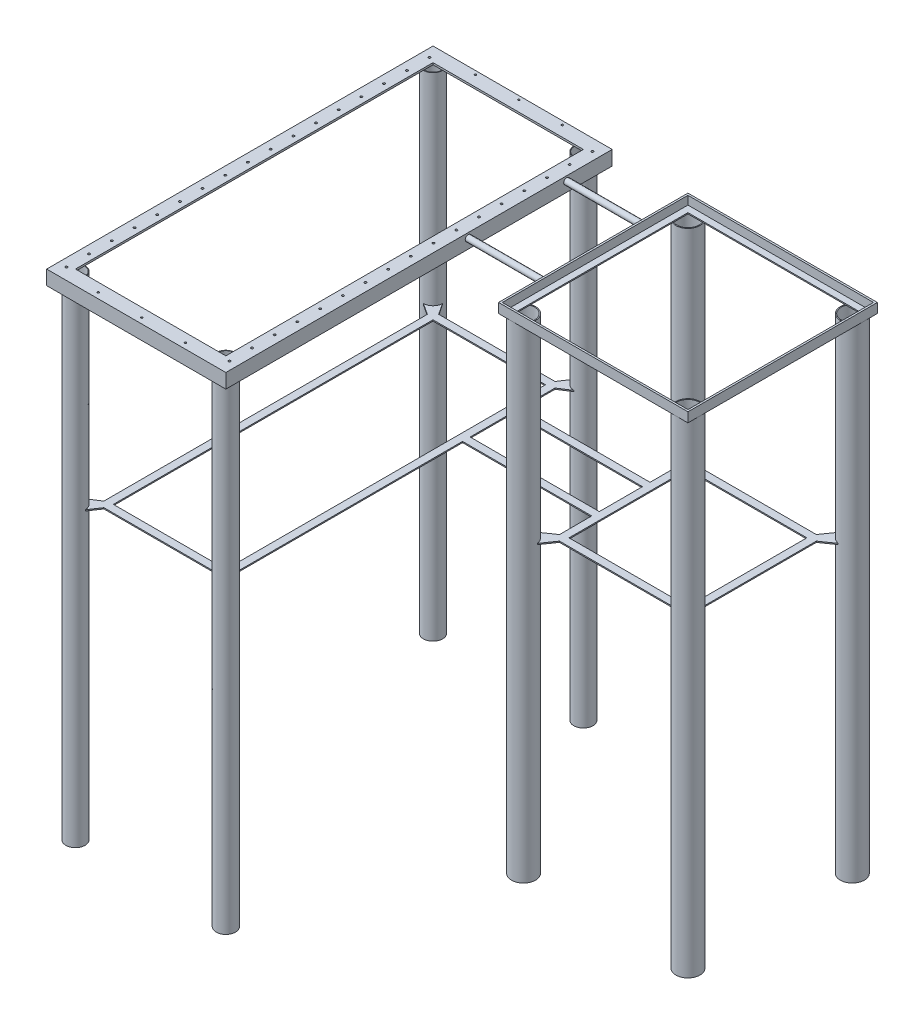
from build123d import *

# Parameters (mm, degrees)
CROQUIS1_W               = 473
CROQUIS1_H               = 1020
CROQUIS1_W_2             = 397
CROQUIS1_H_2             = 944
SALIENTE_EXTRUIR1_DEPTH  = 5
CROQUIS2_W               = 473
CROQUIS2_H               = 1020
CROQUIS2_W_2             = 463
CROQUIS2_H_2             = 1010
SALIENTE_EXTRUIR2_DEPTH  = 33
CROQUIS3_R               = 25.4
CROQUIS3_R_2             = 23.9
SALIENTE_EXTRUIR3_DEPTH  = 1300
SALIENTE_EXTRUIR4_START  = 533
CROQUIS4_W               = 337
CROQUIS4_H               = 884
CROQUIS4_W_2             = 297
CROQUIS4_H_2             = 844
SALIENTE_EXTRUIR4_DEPTH  = 3
SALIENTE_EXTRUIR5_DEPTH  = 3
SALIENTE_EXTRUIR6_START  = -22.225
CROQUIS6_W               = 500
CROQUIS6_H               = 500
CROQUIS6_W_2             = 455.55
CROQUIS6_H_2             = 455.55
SALIENTE_EXTRUIR6_DEPTH  = 3
CROQUIS7_W               = 500
CROQUIS7_H               = 500
CROQUIS7_W_2             = 490
CROQUIS7_H_2             = 490
SALIENTE_EXTRUIR7_DEPTH  = 25.4
SALIENTE_EXTRUIR8_REACH  = 1552.171
CROQUIS9_R               = 7.9375
CROQUIS10_R              = 31.75
CROQUIS10_R_2            = 29.25
SALIENTE_EXTRUIR9_DEPTH  = 1279.775
CROQUIS11_W              = 354
CROQUIS11_H              = 354
CROQUIS11_W_2            = 314
CROQUIS11_H_2            = 314
SALIENTE_EXTRUIR10_DEPTH = 3
SALIENTE_EXTRUIR11_START = -3
CROQUIS12_W              = 341
CROQUIS12_H              = 20
SALIENTE_EXTRUIR11_DEPTH = 3
CORTE_EXTRUS_O1_REACH    = 1687.277
ESBO_O1_R                = 2.5
ESBO_O2_R                = 2.87
CORTE_EXTRUS_O2_DEPTH    = 5


with BuildPart() as part:
    # Croquis1 → Saliente-Extruir1 (new body)
    with BuildSketch(Plane(origin=(0, 0, 0), x_dir=(1, 0, 0), z_dir=(0, 1, 0))):
        Rectangle(CROQUIS1_W, CROQUIS1_H)
        Rectangle(CROQUIS1_W_2, CROQUIS1_H_2, mode=Mode.SUBTRACT)
    extrude(amount=SALIENTE_EXTRUIR1_DEPTH)

    # Croquis2 → Saliente-Extruir2 (add)
    with BuildSketch(Plane.XZ):
        Rectangle(CROQUIS2_W, CROQUIS2_H)
        Rectangle(CROQUIS2_W_2, CROQUIS2_H_2, mode=Mode.SUBTRACT)
    extrude(amount=SALIENTE_EXTRUIR2_DEPTH)

    # Croquis3 → Saliente-Extruir3 (add)
    # profile 1 of 4: a face of its own
    with BuildSketch(Plane.XZ):
        with Locations(Location((-198.5, -472, 0), (0, 0, 90))):
            Circle(CROQUIS3_R)
        with Locations(Location((-198.5, -472, 0), (0, 0, 90))):
            Circle(CROQUIS3_R_2, mode=Mode.SUBTRACT)
    # profile 2 of 4: a face of its own
    with BuildSketch(Plane.XZ):
        with Locations(Location((198.5, -472, 0), (0, 0, 90))):
            Circle(CROQUIS3_R)
        with Locations(Location((198.5, -472, 0), (0, 0, 90))):
            Circle(CROQUIS3_R_2, mode=Mode.SUBTRACT)
    # profile 3 of 4: a face of its own
    with BuildSketch(Plane.XZ):
        with Locations(Location((-198.5, 472, 0), (0, 0, 90))):
            Circle(CROQUIS3_R)
        with Locations(Location((-198.5, 472, 0), (0, 0, 90))):
            Circle(CROQUIS3_R_2, mode=Mode.SUBTRACT)
    # profile 4 of 4: a face of its own
    with BuildSketch(Plane.XZ):
        with Locations(Location((198.5, 472, 0), (0, 0, 270))):
            Circle(CROQUIS3_R)
        with Locations(Location((198.5, 472, 0), (0, 0, 270))):
            Circle(CROQUIS3_R_2, mode=Mode.SUBTRACT)
    extrude(amount=SALIENTE_EXTRUIR3_DEPTH)



with BuildPart() as body_2:
    # Croquis4 → Saliente-Extruir4 (new body)
    with BuildSketch(Plane.XZ.offset(SALIENTE_EXTRUIR4_START)):
        Rectangle(CROQUIS4_W, CROQUIS4_H)
        Rectangle(CROQUIS4_W_2, CROQUIS4_H_2, mode=Mode.SUBTRACT)
    extrude(amount=SALIENTE_EXTRUIR4_DEPTH)


with BuildPart() as part_1:
    add(part.part)

    add(body_2.part)  # Saliente-Extruir5 merges body 2
    # Croquis5 → Saliente-Extruir5 (add)
    with BuildSketch(Plane(origin=(0, -533, 0), x_dir=(1, 0, 0), z_dir=(0, 1, 0))):
        Polygon((153.5, 442), (173.111763161, 471.227063899), (181.912911096, 457.745602739), (198.522990295, 446.600010405), (168.5, 427), (168.5, 442), align=None)
        Polygon((-198.522990295, 446.600010405), (-168.5, 427), (-168.5, 442), (-153.5, 442), (-173.111763161, 471.227063899), (-181.912911096, 457.745602739), align=None)
        Polygon((168.5, -442), (153.5, -442), (173.111763161, -471.227063899), (181.912911096, -457.745602739), (198.522990295, -446.600010405), (168.5, -427), align=None)
        Polygon((-153.5, -442), (-173.111763161, -471.227063899), (-181.912911096, -457.745602739), (-198.522990295, -446.600010405), (-168.5, -427), (-168.5, -442), align=None)
    extrude(amount=-SALIENTE_EXTRUIR5_DEPTH)

    # Croquis9 → Saliente-Extruir8 (add, up to next)
    with BuildSketch(Plane.ZY.offset(-436.5), mode=Mode.PRIVATE) as saliente_extruir8_sk1:
        with Locations((-390, -7.525)):
            Circle(CROQUIS9_R)
    saliente_extruir8_tool1 = extrude(saliente_extruir8_sk1.sketch, amount=SALIENTE_EXTRUIR8_REACH, mode=Mode.PRIVATE) - part_1.part
    # Croquis9 → Saliente-Extruir8 (add, up to next)
    with BuildSketch(Plane.ZY.offset(-436.5), mode=Mode.PRIVATE) as saliente_extruir8_sk2:
        with Locations((-130, -7.525)):
            Circle(CROQUIS9_R)
    saliente_extruir8_tool2 = extrude(saliente_extruir8_sk2.sketch, amount=SALIENTE_EXTRUIR8_REACH, mode=Mode.PRIVATE) - part_1.part


with BuildPart() as body_2_2:
    # Croquis6 → Saliente-Extruir6 (new body)
    with BuildSketch(Plane(origin=(0, 5, 0), x_dir=(1, 0, 0), z_dir=(0, 1, 0)).offset(SALIENTE_EXTRUIR6_START)):
        with Locations((686.5, 260)):
            Rectangle(CROQUIS6_W, CROQUIS6_H)
        with Locations((686.5, 260)):
            Rectangle(CROQUIS6_W_2, CROQUIS6_H_2, mode=Mode.SUBTRACT)
    extrude(amount=-SALIENTE_EXTRUIR6_DEPTH)

    # Croquis7 → Saliente-Extruir7 (add)
    with BuildSketch(Plane.XZ.offset(20.225)):
        with Locations((686.5, -260)):
            Rectangle(CROQUIS7_W, CROQUIS7_H)
        with Locations((686.5, -260)):
            Rectangle(CROQUIS7_W_2, CROQUIS7_H_2, mode=Mode.SUBTRACT)
    extrude(amount=-SALIENTE_EXTRUIR7_DEPTH)


with BuildPart() as part_2:
    add(part_1.part)

    add(body_2_2.part)  # Saliente-Extruir8 merges body 2 2
    add(saliente_extruir8_tool1.solids().sort_by_distance((436.5, -7.525, -390))[0])
    add(saliente_extruir8_tool2.solids().sort_by_distance((436.5, -7.525, -130))[0])

    # Croquis10 → Saliente-Extruir9 (add)
    # profile 1 of 4: a face of its own
    with BuildSketch(Plane.XZ.offset(20.225)):
        with Locations(Location((469.5, -43, 0), (0, 0, 90))):
            Circle(CROQUIS10_R)
        with Locations(Location((469.5, -43, 0), (0, 0, 90))):
            Circle(CROQUIS10_R_2, mode=Mode.SUBTRACT)
    # profile 2 of 4: a face of its own
    with BuildSketch(Plane.XZ.offset(20.225)):
        with Locations(Location((469.5, -477, 0), (0, 0, 90))):
            Circle(CROQUIS10_R)
        with Locations(Location((469.5, -477, 0), (0, 0, 90))):
            Circle(CROQUIS10_R_2, mode=Mode.SUBTRACT)
    # profile 3 of 4: a face of its own
    with BuildSketch(Plane.XZ.offset(20.225)):
        with Locations(Location((903.5, -477, 0), (0, 0, 90))):
            Circle(CROQUIS10_R)
        with Locations(Location((903.5, -477, 0), (0, 0, 90))):
            Circle(CROQUIS10_R_2, mode=Mode.SUBTRACT)
    # profile 4 of 4: a face of its own
    with BuildSketch(Plane.XZ.offset(20.225)):
        with Locations(Location((903.5, -43, 0), (0, 0, 90))):
            Circle(CROQUIS10_R)
        with Locations(Location((903.5, -43, 0), (0, 0, 90))):
            Circle(CROQUIS10_R_2, mode=Mode.SUBTRACT)
    extrude(amount=SALIENTE_EXTRUIR9_DEPTH)



with BuildPart() as body_2_3:
    # Croquis11 → Saliente-Extruir10 (new body)
    with BuildSketch(Plane(origin=(0, -533, 0), x_dir=(1, 0, 0), z_dir=(0, 1, 0))):
        with Locations((686.5, 260)):
            Rectangle(CROQUIS11_W, CROQUIS11_H)
        with Locations((686.5, 260)):
            Rectangle(CROQUIS11_W_2, CROQUIS11_H_2, mode=Mode.SUBTRACT)
    extrude(amount=-SALIENTE_EXTRUIR10_DEPTH)


with BuildPart() as part_3:
    add(part_2.part)

    add(body_2_3.part)  # Saliente-Extruir11 merges body 2 3
    # Croquis12 → Saliente-Extruir11 (add)
    with BuildSketch(Plane(origin=(0, -533, 0), x_dir=(1, 0, 0), z_dir=(0, 1, 0)).offset(SALIENTE_EXTRUIR11_START)):
        Polygon((509.5, 422), (475.09561414, 446.090210327), (491.346586648, 453.961138226), (500.409789673, 471.40438586), (524.5, 437), (509.5, 437), align=None)
        Polygon((863.5, 437), (863.5, 422), (897.90438586, 446.090210327), (881.653413352, 453.961138226), (872.590210327, 471.40438586), (848.5, 437), align=None)
        Polygon((863.5, 98), (897.90438586, 73.909789673), (881.653413352, 66.038861774), (872.590210327, 48.59561414), (848.5, 83), (863.5, 83), align=None)
        Polygon((509.5, 83), (509.5, 98), (475.09561414, 73.909789673), (491.346586648, 66.038861774), (500.409789673, 48.59561414), (524.5, 83), align=None)
        with Locations((339, 327)):
            Rectangle(CROQUIS12_W, CROQUIS12_H)
        with Locations((339, 193)):
            Rectangle(CROQUIS12_W, CROQUIS12_H)
    extrude(amount=SALIENTE_EXTRUIR11_DEPTH)

    # Esboço1 → Corte-extrusão1 (cut, up to next)
    with BuildSketch(Plane(origin=(0, 5, 0), x_dir=(1, 0, 0), z_dir=(0, 1, 0)), mode=Mode.PRIVATE) as corte_extrus_o1_sk1:
        with Locations(Location((-114.988057923, -495.2375, 0), (0, 0, 270))):
            Circle(ESBO_O1_R)
    corte_extrus_o1_tool1 = extrude(corte_extrus_o1_sk1.sketch, amount=-CORTE_EXTRUS_O1_REACH, mode=Mode.PRIVATE) & part_3.part
    # Esboço1 → Corte-extrusão1 (cut, up to next)
    with BuildSketch(Plane(origin=(0, 5, 0), x_dir=(1, 0, 0), z_dir=(0, 1, 0)), mode=Mode.PRIVATE) as corte_extrus_o1_sk2:
        with Locations(Location((0.011942077, -495.2375, 0), (0, 0, 270))):
            Circle(ESBO_O1_R)
    corte_extrus_o1_tool2 = extrude(corte_extrus_o1_sk2.sketch, amount=-CORTE_EXTRUS_O1_REACH, mode=Mode.PRIVATE) & part_3.part
    # Esboço1 → Corte-extrusão1 (cut, up to next)
    with BuildSketch(Plane(origin=(0, 5, 0), x_dir=(1, 0, 0), z_dir=(0, 1, 0)), mode=Mode.PRIVATE) as corte_extrus_o1_sk3:
        with Locations(Location((115.011942077, -495.2375, 0), (0, 0, 270))):
            Circle(ESBO_O1_R)
    corte_extrus_o1_tool3 = extrude(corte_extrus_o1_sk3.sketch, amount=-CORTE_EXTRUS_O1_REACH, mode=Mode.PRIVATE) & part_3.part
    # Esboço1 → Corte-extrusão1 (cut, up to next)
    with BuildSketch(Plane(origin=(0, 5, 0), x_dir=(1, 0, 0), z_dir=(0, 1, 0)), mode=Mode.PRIVATE) as corte_extrus_o1_sk4:
        with Locations(Location((-114.988057923, 500.2375, 0), (0, 0, 270))):
            Circle(ESBO_O1_R)
    corte_extrus_o1_tool4 = extrude(corte_extrus_o1_sk4.sketch, amount=-CORTE_EXTRUS_O1_REACH, mode=Mode.PRIVATE) & part_3.part
    # Esboço1 → Corte-extrusão1 (cut, up to next)
    with BuildSketch(Plane(origin=(0, 5, 0), x_dir=(1, 0, 0), z_dir=(0, 1, 0)), mode=Mode.PRIVATE) as corte_extrus_o1_sk5:
        with Locations(Location((0.011942077, 500.2375, 0), (0, 0, 270))):
            Circle(ESBO_O1_R)
    corte_extrus_o1_tool5 = extrude(corte_extrus_o1_sk5.sketch, amount=-CORTE_EXTRUS_O1_REACH, mode=Mode.PRIVATE) & part_3.part
    # Esboço1 → Corte-extrusão1 (cut, up to next)
    with BuildSketch(Plane(origin=(0, 5, 0), x_dir=(1, 0, 0), z_dir=(0, 1, 0)), mode=Mode.PRIVATE) as corte_extrus_o1_sk6:
        with Locations(Location((115.011942077, 500.2375, 0), (0, 0, 270))):
            Circle(ESBO_O1_R)
    corte_extrus_o1_tool6 = extrude(corte_extrus_o1_sk6.sketch, amount=-CORTE_EXTRUS_O1_REACH, mode=Mode.PRIVATE) & part_3.part
    add(corte_extrus_o1_tool1.solids().sort_by_distance((-114.988058, 5, 495.2375))[0], mode=Mode.SUBTRACT)
    add(corte_extrus_o1_tool2.solids().sort_by_distance((0.011942, 5, 495.2375))[0], mode=Mode.SUBTRACT)
    add(corte_extrus_o1_tool3.solids().sort_by_distance((115.011942, 5, 495.2375))[0], mode=Mode.SUBTRACT)
    add(corte_extrus_o1_tool4.solids().sort_by_distance((-114.988058, 5, -500.2375))[0], mode=Mode.SUBTRACT)
    add(corte_extrus_o1_tool5.solids().sort_by_distance((0.011942, 5, -500.2375))[0], mode=Mode.SUBTRACT)
    add(corte_extrus_o1_tool6.solids().sort_by_distance((115.011942, 5, -500.2375))[0], mode=Mode.SUBTRACT)

    # Esboço2 → Corte-extrusão2 (cut)
    with BuildSketch(Plane(origin=(0, 5, 0), x_dir=(1, 0, 0), z_dir=(0, 1, 0))):
        with Locations(Location((215.04, -479.28, 0), (0, 0, 270))):
            Circle(ESBO_O2_R)
        with Locations(Location((215.04, -419.37, 0), (0, 0, 270))):
            Circle(ESBO_O2_R)
        with Locations(Location((215.04, -359.46, 0), (0, 0, 270))):
            Circle(ESBO_O2_R)
        with Locations(Location((215.04, -299.55, 0), (0, 0, 270))):
            Circle(ESBO_O2_R)
        with Locations(Location((215.04, -239.64, 0), (0, 0, 270))):
            Circle(ESBO_O2_R)
        with Locations(Location((215.04, -179.73, 0), (0, 0, 270))):
            Circle(ESBO_O2_R)
        with Locations(Location((215.04, -119.82, 0), (0, 0, 270))):
            Circle(ESBO_O2_R)
        with Locations(Location((215.04, -59.91, 0), (0, 0, 270))):
            Circle(ESBO_O2_R)
        with Locations(Location((215.04, 0, 0), (0, 0, 270))):
            Circle(ESBO_O2_R)
        with Locations(Location((215.04, 59.91, 0), (0, 0, 270))):
            Circle(ESBO_O2_R)
        with Locations(Location((215.04, 119.82, 0), (0, 0, 270))):
            Circle(ESBO_O2_R)
        with Locations(Location((215.04, 179.73, 0), (0, 0, 270))):
            Circle(ESBO_O2_R)
        with Locations(Location((215.04, 239.64, 0), (0, 0, 270))):
            Circle(ESBO_O2_R)
        with Locations(Location((215.04, 299.55, 0), (0, 0, 270))):
            Circle(ESBO_O2_R)
        with Locations(Location((215.04, 359.46, 0), (0, 0, 270))):
            Circle(ESBO_O2_R)
        with Locations(Location((215.04, 419.37, 0), (0, 0, 270))):
            Circle(ESBO_O2_R)
        with Locations(Location((215.04, 479.28, 0), (0, 0, 270))):
            Circle(ESBO_O2_R)
        with Locations(Location((-215.04, -239.64, 0), (0, 0, 270))):
            Circle(ESBO_O2_R)
        with Locations(Location((-215.04, -299.55, 0), (0, 0, 270))):
            Circle(ESBO_O2_R)
        with Locations(Location((-215.04, -359.46, 0), (0, 0, 270))):
            Circle(ESBO_O2_R)
        with Locations(Location((-215.04, -419.37, 0), (0, 0, 270))):
            Circle(ESBO_O2_R)
        with Locations(Location((-215.04, -479.28, 0), (0, 0, 270))):
            Circle(ESBO_O2_R)
        with Locations(Location((-215.04, 479.28, 0), (0, 0, 270))):
            Circle(ESBO_O2_R)
        with Locations(Location((-215.04, 419.37, 0), (0, 0, 270))):
            Circle(ESBO_O2_R)
        with Locations(Location((-215.04, 359.46, 0), (0, 0, 270))):
            Circle(ESBO_O2_R)
        with Locations(Location((-215.04, 299.55, 0), (0, 0, 270))):
            Circle(ESBO_O2_R)
        with Locations(Location((-215.04, 239.64, 0), (0, 0, 270))):
            Circle(ESBO_O2_R)
        with Locations(Location((-215.04, 179.73, 0), (0, 0, 270))):
            Circle(ESBO_O2_R)
        with Locations(Location((-215.04, 119.82, 0), (0, 0, 270))):
            Circle(ESBO_O2_R)
        with Locations(Location((-215.04, 59.91, 0), (0, 0, 270))):
            Circle(ESBO_O2_R)
        with Locations(Location((-215.04, 0, 0), (0, 0, 270))):
            Circle(ESBO_O2_R)
        with Locations(Location((-215.04, -59.91, 0), (0, 0, 270))):
            Circle(ESBO_O2_R)
        with Locations(Location((-215.04, -119.82, 0), (0, 0, 270))):
            Circle(ESBO_O2_R)
        with Locations(Location((-215.04, -179.73, 0), (0, 0, 270))):
            Circle(ESBO_O2_R)
    extrude(amount=-CORTE_EXTRUS_O2_DEPTH, mode=Mode.SUBTRACT)


solid = part_3.part
